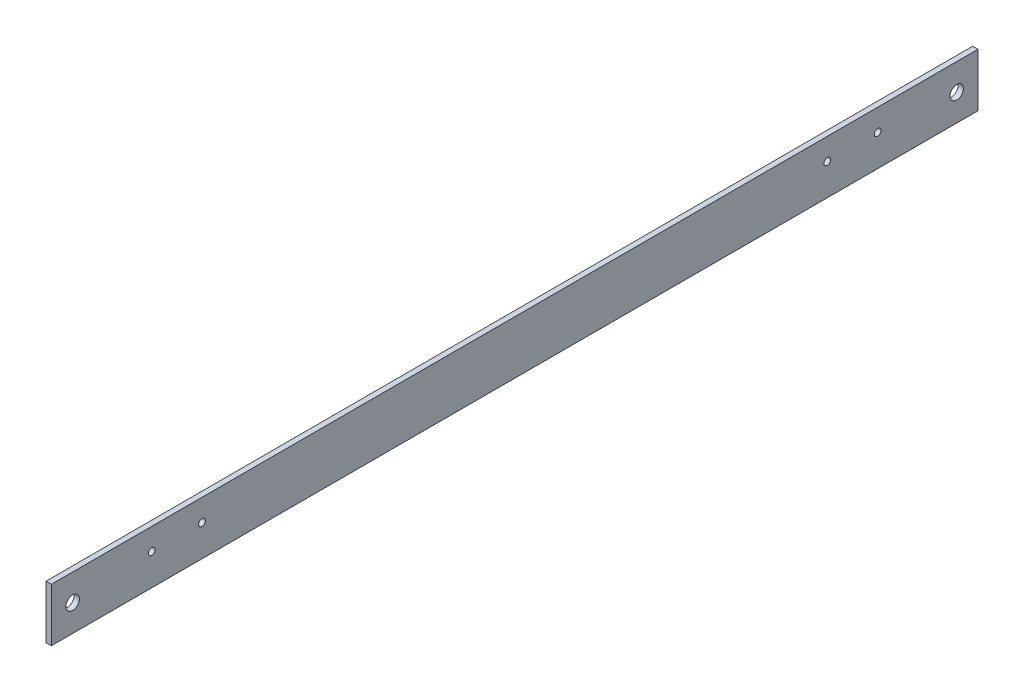
from build123d import *

# Parameters (mm, degrees)
SKETCH1_W           = 552.45
SKETCH1_H           = 31.75
SKETCH1_R           = 4
SKETCH1_R_2         = 2
BOSS_EXTRUDE2_DEPTH = 3.175


with BuildPart() as part:
    # Sketch1 → Boss-Extrude2 (new body)
    with BuildSketch(Plane(origin=(0, 0, 0), x_dir=(0, 0, -1), z_dir=(1, 0, 0))):
        with Locations((276.225, 15.875)):
            Rectangle(SKETCH1_W, SKETCH1_H)
        with Locations((12.7, 15.875)):
            Circle(SKETCH1_R, mode=Mode.SUBTRACT)
        with Locations((539.75, 15.875)):
            Circle(SKETCH1_R, mode=Mode.SUBTRACT)
        with Locations((462.625, 18.75)):
            Circle(SKETCH1_R_2, mode=Mode.SUBTRACT)
        with Locations((492.625, 18.75)):
            Circle(SKETCH1_R_2, mode=Mode.SUBTRACT)
        with Locations((59.825, 18.75)):
            Circle(SKETCH1_R_2, mode=Mode.SUBTRACT)
        with Locations((89.825, 18.75)):
            Circle(SKETCH1_R_2, mode=Mode.SUBTRACT)
    extrude(amount=BOSS_EXTRUDE2_DEPTH)


solid = part.part
